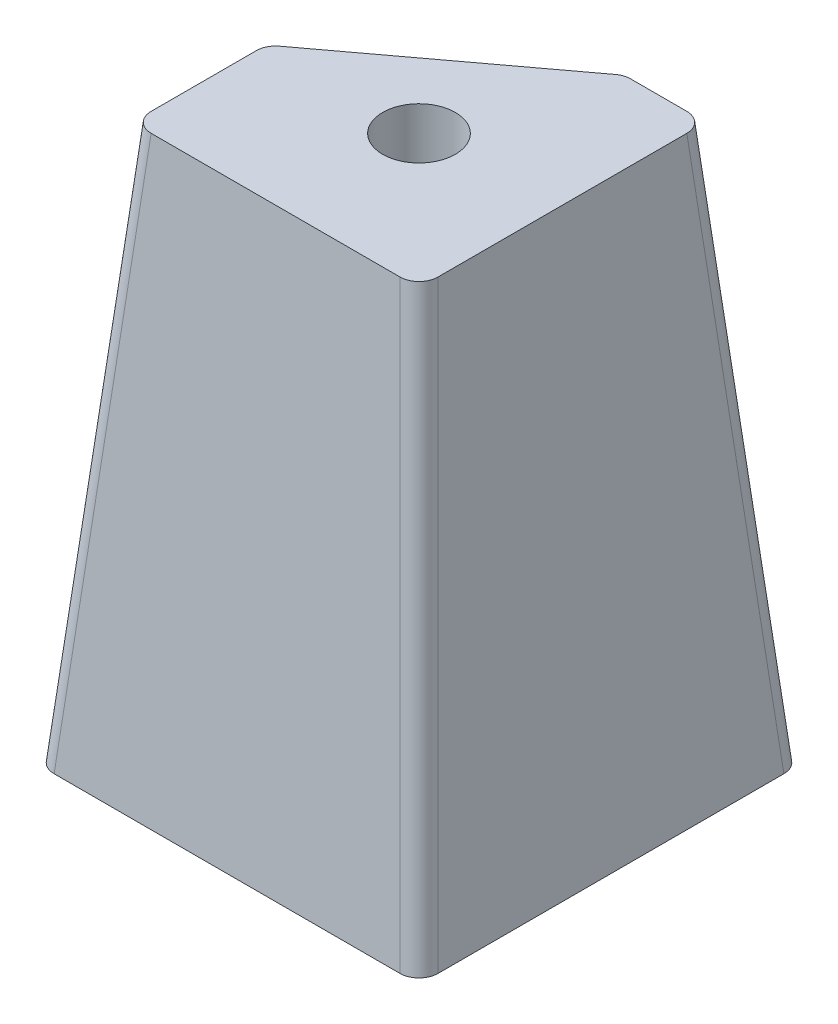
from build123d import *

# Parameters (mm, degrees)
BOSS_EXTRUDE1_DEPTH = 29
SKETCH2_R           = 1.5
SKETCH2_R_2         = 2
CUT_EXTRUDE1_DEPTH  = 10
SKETCH3_R           = 1.9
CUT_EXTRUDE2_DEPTH  = 6
DRAFT1_ANGLE        = 5
FILLET1_R           = 1


with BuildPart() as part:
    # Sketch1 → Boss-Extrude1 (new body)
    with BuildSketch(Plane(origin=(0, 0, 0), x_dir=(1, 0, 0), z_dir=(0, 1, 0))):
        Polygon((-4.579646018, -0.201327434), (6.153177369, 7.798672566), (10.420353982, 7.798672566), (10.420353982, -7.201327434), (-4.579646018, -7.201327434), align=None)
    extrude(amount=BOSS_EXTRUDE1_DEPTH)

    # Sketch2 → Cut-Extrude1 (cut)
    with BuildSketch(Plane.XZ):
        with Locations(Location((-0.579646018, 2.201327434, 0), (0, 0, 270))):
            Circle(SKETCH2_R)
        with Locations(Location((7.420353982, 2.201327434, 0), (0, 0, 270))):
            Circle(SKETCH2_R_2)
    extrude(amount=-CUT_EXTRUDE1_DEPTH, mode=Mode.SUBTRACT)

    # Sketch3 → Cut-Extrude2 (cut)
    with BuildSketch(Plane(origin=(0, 29, 0), x_dir=(1, 0, 0), z_dir=(0, 1, 0))):
        with Locations(Location((3.420353982, -0.201327434, 0), (0, 0, 270))):
            Circle(SKETCH3_R)
    extrude(amount=-CUT_EXTRUDE2_DEPTH, mode=Mode.SUBTRACT)

    # Draft1
    draft1_faces = [part.faces().sort_by_distance(p)[0] for p in [
        (8.286765676, 14.5, -7.798672566),
        (10.420353982, 14.5, -0.298672566),
        (2.920353982, 14.5, 7.201327434),
        (-4.579646018, 14.5, 3.701327434),
        (0.786765676, 14.5, -3.798672566),
    ]]
    draft(draft1_faces, Plane.ZX.offset(29), DRAFT1_ANGLE)

    # Fillet1
    fillet1_edges = [part.edges().sort_by_distance(p)[0] for p in [
        (-5.848231639, 14.5, -0.435318187),
        (5.7324043, 14.5, -9.067258187),
        (11.688939603, 14.5, -9.067258187),
        (11.688939603, 14.5, 8.469913055),
        (-5.848231639, 14.5, 8.469913055),
    ]]
    fillet(fillet1_edges, radius=FILLET1_R)


solid = part.part
